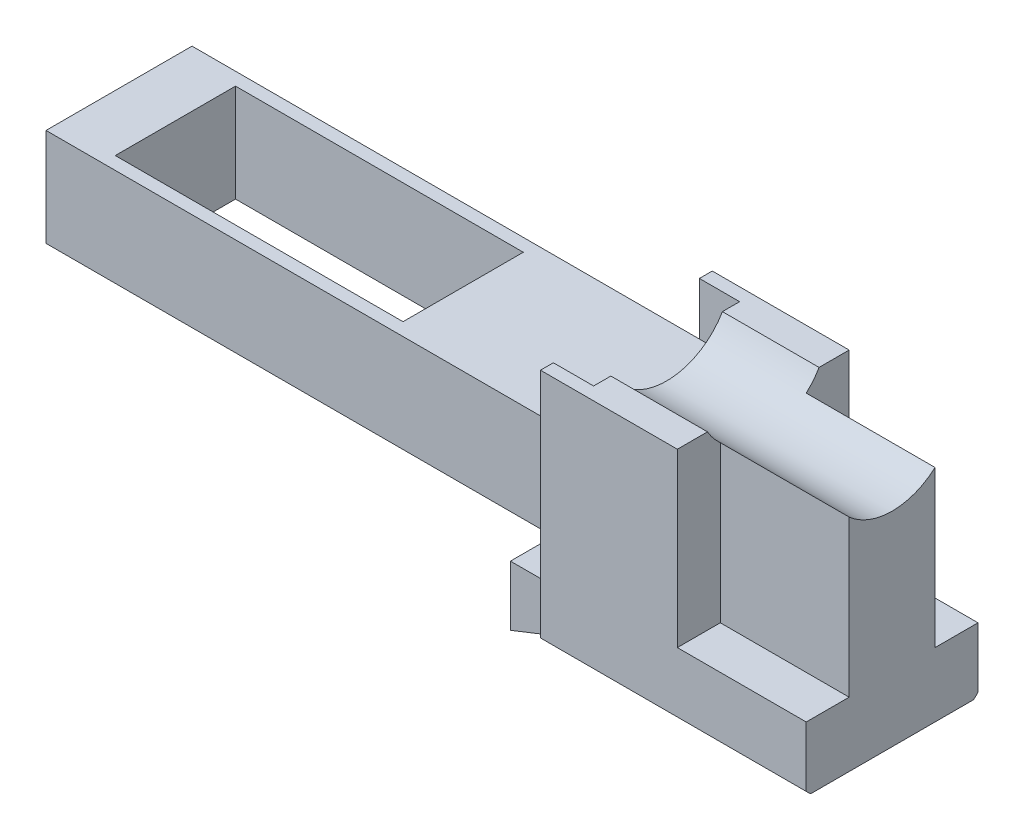
from build123d import *

# Parameters (mm, degrees)
EXTRUDE_1_DEPTH     = 17
EXTRUDE_2_DEPTH     = 20
SKETCH_2_W          = 127.5
SKETCH_2_H          = 12.22
CUT_EXTRUDE_1_DEPTH = 17
SKETCH_6_W          = 30
SKETCH_6_H          = 40
CUT_EXTRUDE_2_DEPTH = 10
SKETCH_7_W          = 30
SKETCH_7_H          = 40
CUT_EXTRUDE_3_DEPTH = 10
SKETCH_8_W          = 67
SKETCH_8_H          = 22.78
CUT_EXTRUDE_4_DEPTH = 14
CUT_EXTRUDE_6_DEPTH = 7.5
CUT_EXTRUDE_7_REACH = 192.46
CHAMFER_1_SIZE      = 1


with BuildPart() as part:
    # 스케치1 → 보스-돌출1 (new, symmetric)
    with BuildSketch(Plane.XY):
        Polygon((180, 0), (0, 0), (0, -35), (118.13, -35), (118.13, -45), (108.13, -45), (108.13, -58.95), (118.13, -55), (180, -55), align=None)
    extrude(amount=EXTRUDE_1_DEPTH, both=True)

    # 스케치1<3> → 보스-돌출2 (add, symmetric)
    with BuildSketch(Plane.XY):
        Polygon((180, 0), (127.5, 0), (118.13, 0), (118.13, -10), (118.13, -35), (118.13, -45), (118.13, -55), (180, -55), align=None)
    extrude(amount=EXTRUDE_2_DEPTH, both=True)

    # 스케치2 → 컷-돌출1 (cut, symmetric)
    with BuildSketch(Plane.XY):
        with Locations((63.75, -6.11)):
            Rectangle(SKETCH_2_W, SKETCH_2_H)
    extrude(amount=CUT_EXTRUDE_1_DEPTH, both=True, mode=Mode.SUBTRACT)

    # 스케치6 → 컷-돌출2 (cut)
    with BuildSketch(Plane.XY.offset(20)):
        with Locations((165, -20)):
            Rectangle(SKETCH_6_W, SKETCH_6_H)
    extrude(amount=-CUT_EXTRUDE_2_DEPTH, mode=Mode.SUBTRACT)

    # 스케치7 → 컷-돌출3 (cut)
    with BuildSketch(Plane(origin=(0, 0, -20), x_dir=(-1, 0, 0), z_dir=(0, 0, -1))):
        with Locations((-165, -20)):
            Rectangle(SKETCH_7_W, SKETCH_7_H)
    extrude(amount=-CUT_EXTRUDE_3_DEPTH, mode=Mode.SUBTRACT)

    # 스케치8 → 컷-돌출4 (cut, symmetric)
    with BuildSketch(Plane.XY):
        with Locations((46.63, -23.61)):
            Rectangle(SKETCH_8_W, SKETCH_8_H)
    extrude(amount=CUT_EXTRUDE_4_DEPTH, both=True, mode=Mode.SUBTRACT)

    # 스케치13 → 컷-돌출6 (cut, symmetric)
    with BuildSketch(Plane.XY):
        Polygon((80.13, -16.22), (83.13, -19.22), (80.13, -22.22), align=None)
    extrude(amount=CUT_EXTRUDE_6_DEPTH, both=True, mode=Mode.SUBTRACT)

    # 컷-돌출7: up to this face of the body (flat: up to its plane)
    cut_extrude_7_end = Plane(part.part.faces().sort_by_distance((127.5, -6.11, 0))[0])
    # 스케치14 → 컷-돌출7 (cut, up to the picked face)
    with BuildSketch(Plane(origin=(180, 0, 0), x_dir=(0, 0, -1), z_dir=(1, 0, 0)), mode=Mode.PRIVATE) as cut_extrude_7_sk1:
        with BuildLine():
            Line((-12.990381057, 0), (12.990381057, 0))
            ThreePointArc((12.990381057, 0), (0, -7.5), (-12.990381057, 0))
        make_face()
    cut_extrude_7_tool1 = split(extrude(cut_extrude_7_sk1.sketch, amount=-CUT_EXTRUDE_7_REACH, mode=Mode.PRIVATE), bisect_by=cut_extrude_7_end, keep=Keep.BOTH, mode=Mode.PRIVATE)
    add(cut_extrude_7_tool1.solids().sort_by(Axis((180, -3.075302, 0), (-1, 0, 0)))[0], mode=Mode.SUBTRACT)

    # 모따기1
    chamfer_1_edges = [part.edges().sort_by_distance(p)[0] for p in [
        (149.065, -55, -20),
        (149.065, -55, 20),
    ]]
    chamfer(chamfer_1_edges, length=CHAMFER_1_SIZE)


solid = part.part
